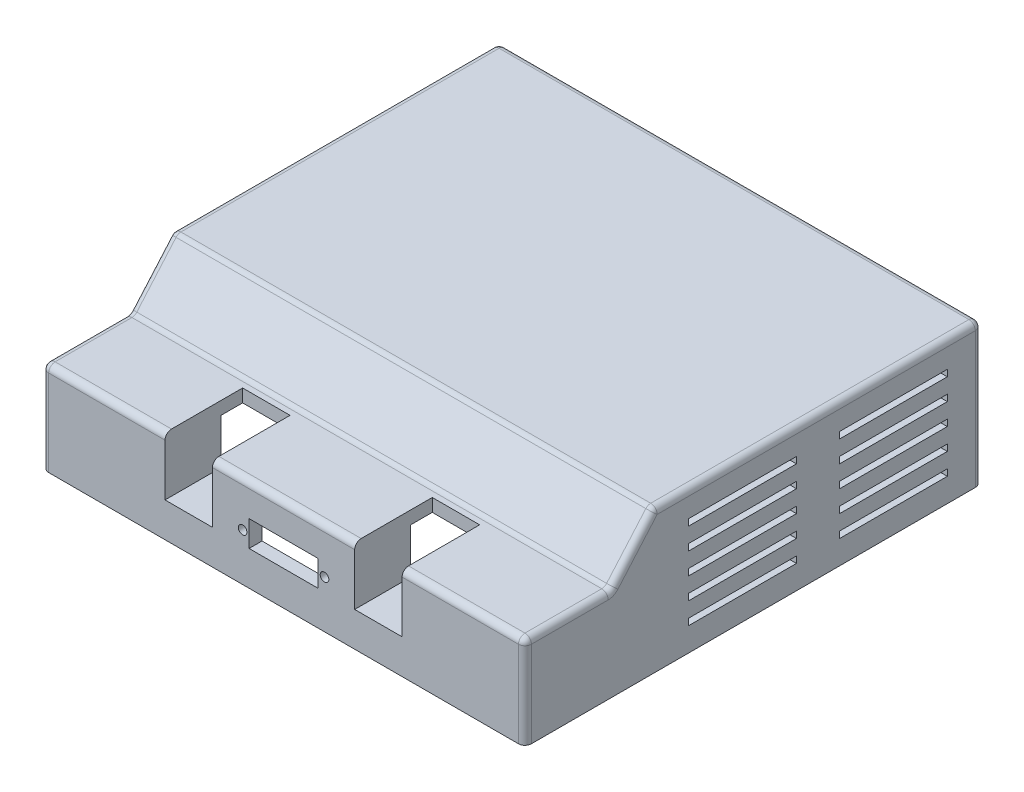
from build123d import *

# Parameters (mm, degrees)
SKETCH1_W            = 112
SKETCH1_H            = 106
BOSS_EXTRUDE1_DEPTH  = 3
SKETCH3_W            = 112
SKETCH3_H            = 106
BOSS_EXTRUDE2_DEPTH  = 30
SKETCH4_R            = 1.5
CUT_EXTRUDE1_DEPTH   = 15
SKETCH5_R            = 1
SKETCH5_W            = 16
SKETCH5_H            = 6
CUT_EXTRUDE2_DEPTH   = 3
SKETCH7_W            = 30
SKETCH7_H            = 14.5
CUT_EXTRUDE4_DEPTH   = 112
SKETCH9_W            = 112
SKETCH9_H            = 20
BOSS_EXTRUDE3_DEPTH  = 3
SKETCH10_W           = 11
SKETCH10_H           = 18
CUT_EXTRUDE5_DEPTH   = 13.5
BOSS_EXTRUDE4_DEPTH  = 112
BOSS_EXTRUDE5_DEPTH  = 3
BOSS_EXTRUDE6_DEPTH  = 3
SKETCH19_W           = 9
SKETCH19_H           = 10
CUT_EXTRUDE7_DEPTH   = 3
SKETCH20_W           = 12
SKETCH20_H           = 13
SKETCH20_W_2         = 9
SKETCH20_H_2         = 10
BOSS_EXTRUDE8_DEPTH  = 3
SKETCH21_W           = 15
SKETCH21_H           = 8.5
CUT_EXTRUDE8_DEPTH   = 3
SKETCH23_W           = 25
SKETCH23_H           = 1.5
CUT_EXTRUDE9_DEPTH   = 3
SKETCH24_W           = 25
SKETCH24_H           = 1.5
CUT_EXTRUDE10_DEPTH  = 3
FILLET1_R            = 1.5
BOSS_EXTRUDE16_DEPTH = 10


with BuildPart() as part:
    # Sketch1 → Boss-Extrude1 (new body)
    with BuildSketch(Plane(origin=(0, 0, 0), x_dir=(1, 0, 0), z_dir=(0, 1, 0))):
        Rectangle(SKETCH1_W, SKETCH1_H)
    extrude(amount=BOSS_EXTRUDE1_DEPTH)

    # Sketch3 → Boss-Extrude2 (add)
    with BuildSketch(Plane.XZ):
        Rectangle(SKETCH3_W, SKETCH3_H)
        with BuildLine():
            Line((44.381049961, -50), (-44.381049961, -50))
            ThreePointArc((-44.381049961, -50), (-47.452820621, -44.577071492), (-52.830188679, -41.426223771))
            Line((-52.830188679, -41.426223771), (-52.830188679, 41.426223771))
            ThreePointArc((-52.830188679, 41.426223771), (-47.452820621, 44.577071492), (-44.381049961, 50))
            Line((-44.381049961, 50), (44.381049961, 50))
            ThreePointArc((44.381049961, 50), (47.452820621, 44.577071492), (52.830188679, 41.426223771))
            Line((52.830188679, 41.426223771), (52.830188679, -41.426223771))
            ThreePointArc((52.830188679, -41.426223771), (47.452820621, -44.577071492), (44.381049961, -50))
        make_face(mode=Mode.SUBTRACT)
    extrude(amount=BOSS_EXTRUDE2_DEPTH)

    # Sketch4 → Cut-Extrude1 (cut)
    with BuildSketch(Plane.XZ.offset(30)):
        with Locations((-51.5, -48.5)):
            Circle(SKETCH4_R)
        with Locations((51.5, -48.5)):
            Circle(SKETCH4_R)
        with Locations((-51.5, 48.5)):
            Circle(SKETCH4_R)
        with Locations((51.5, 48.5)):
            Circle(SKETCH4_R)
    extrude(amount=-CUT_EXTRUDE1_DEPTH, mode=Mode.SUBTRACT)

    # Sketch5 → Cut-Extrude2 (cut)
    with BuildSketch(Plane.XY.offset(53)):
        with Locations((9.5, -19)):
            Circle(SKETCH5_R)
        with Locations((-9.5, -19)):
            Circle(SKETCH5_R)
        with Locations((0, -19)):
            Rectangle(SKETCH5_W, SKETCH5_H)
    extrude(amount=-CUT_EXTRUDE2_DEPTH, mode=Mode.SUBTRACT)

    # Sketch7 → Cut-Extrude4 (cut)
    with BuildSketch(Plane(origin=(56, 0, 0), x_dir=(0, 0, -1), z_dir=(1, 0, 0))):
        with Locations((-38, -4.25)):
            Rectangle(SKETCH7_W, SKETCH7_H)
    extrude(amount=-CUT_EXTRUDE4_DEPTH, mode=Mode.SUBTRACT)

    # Sketch9 → Boss-Extrude3 (add)
    with BuildSketch(Plane(origin=(0, -11.5, 0), x_dir=(1, 0, 0), z_dir=(0, 1, 0))):
        with Locations((0, -43)):
            Rectangle(SKETCH9_W, SKETCH9_H)
    extrude(amount=BOSS_EXTRUDE3_DEPTH)

    # Sketch10 → Cut-Extrude5 (cut)
    with BuildSketch(Plane(origin=(0, -8.5, 0), x_dir=(1, 0, 0), z_dir=(0, 1, 0))):
        with Locations((-22, -44)):
            Rectangle(SKETCH10_W, SKETCH10_H)
        with Locations((22, -44)):
            Rectangle(SKETCH10_W, SKETCH10_H)
    extrude(amount=-CUT_EXTRUDE5_DEPTH, mode=Mode.SUBTRACT)

    # Sketch11 → Boss-Extrude4 (add)
    with BuildSketch(Plane(origin=(56, 0, 0), x_dir=(0, 0, -1), z_dir=(1, 0, 0))):
        Polygon((-33, -8.5), (-23, 3), (-23, 0), (-33, -11.5), align=None)
    extrude(amount=-BOSS_EXTRUDE4_DEPTH)

    # Sketch13 → Boss-Extrude5 (add)
    with BuildSketch(Plane(origin=(56, 0, 0), x_dir=(0, 0, -1), z_dir=(1, 0, 0))):
        Polygon((-33, -11.5), (-23, 0), (-23, -11.5), align=None)
    extrude(amount=-BOSS_EXTRUDE5_DEPTH)

    # Sketch14 → Boss-Extrude6 (add)
    with BuildSketch(Plane.ZY.offset(56)):
        Polygon((23, 0), (23, -11.5), (33, -11.5), align=None)
    extrude(amount=-BOSS_EXTRUDE6_DEPTH)

    # Sketch19 → Cut-Extrude7 (cut)
    with BuildSketch(Plane(origin=(0, 0, -53), x_dir=(-1, 0, 0), z_dir=(0, 0, -1))):
        with Locations((23, -16.5)):
            Rectangle(SKETCH19_W, SKETCH19_H)
    extrude(amount=-CUT_EXTRUDE7_DEPTH, mode=Mode.SUBTRACT)

    # Sketch20 → Boss-Extrude8 (add)
    with BuildSketch(Plane.XY.offset(-53)):
        with Locations((-23, -16.5)):
            Rectangle(SKETCH20_W, SKETCH20_H)
        with Locations((-23, -16.5)):
            Rectangle(SKETCH20_W_2, SKETCH20_H_2, mode=Mode.SUBTRACT)
    extrude(amount=BOSS_EXTRUDE8_DEPTH)

    # Sketch21 → Cut-Extrude8 (cut)
    with BuildSketch(Plane(origin=(0, 0, -53), x_dir=(-1, 0, 0), z_dir=(0, 0, -1))):
        with Locations((-21, -15)):
            Rectangle(SKETCH21_W, SKETCH21_H)
    extrude(amount=-CUT_EXTRUDE8_DEPTH, mode=Mode.SUBTRACT)

    # Sketch23 → Cut-Extrude9 (cut)
    with BuildSketch(Plane(origin=(56, 0, 0), x_dir=(0, 0, -1), z_dir=(1, 0, 0))):
        with Locations((32.5, -8.75)):
            Rectangle(SKETCH23_W, SKETCH23_H)
        with Locations((32.5, -3.75)):
            Rectangle(SKETCH23_W, SKETCH23_H)
        with Locations((32.5, -13.75)):
            Rectangle(SKETCH23_W, SKETCH23_H)
        with Locations((32.5, -18.75)):
            Rectangle(SKETCH23_W, SKETCH23_H)
        with Locations((32.5, -23.75)):
            Rectangle(SKETCH23_W, SKETCH23_H)
        with Locations((-2.5, -23.75)):
            Rectangle(SKETCH23_W, SKETCH23_H)
        with Locations((-2.5, -18.75)):
            Rectangle(SKETCH23_W, SKETCH23_H)
        with Locations((-2.5, -13.75)):
            Rectangle(SKETCH23_W, SKETCH23_H)
        with Locations((-2.5, -8.75)):
            Rectangle(SKETCH23_W, SKETCH23_H)
        with Locations((-2.5, -3.75)):
            Rectangle(SKETCH23_W, SKETCH23_H)
    extrude(amount=-CUT_EXTRUDE9_DEPTH, mode=Mode.SUBTRACT)

    # Sketch24 → Cut-Extrude10 (cut)
    with BuildSketch(Plane.ZY.offset(56)):
        with Locations((2.5, -7.25)):
            Rectangle(SKETCH24_W, SKETCH24_H)
        with Locations((2.5, -3.75)):
            Rectangle(SKETCH24_W, SKETCH24_H)
        with Locations((2.5, -12.25)):
            Rectangle(SKETCH24_W, SKETCH24_H)
        with Locations((2.5, -17.25)):
            Rectangle(SKETCH24_W, SKETCH24_H)
        with Locations((2.5, -22.25)):
            Rectangle(SKETCH24_W, SKETCH24_H)
        with Locations((-32.5, -22.25)):
            Rectangle(SKETCH24_W, SKETCH24_H)
        with Locations((-32.5, -17.25)):
            Rectangle(SKETCH24_W, SKETCH24_H)
        with Locations((-32.5, -12.25)):
            Rectangle(SKETCH24_W, SKETCH24_H)
        with Locations((-32.5, -7.25)):
            Rectangle(SKETCH24_W, SKETCH24_H)
        with Locations((-32.5, -3.75)):
            Rectangle(SKETCH24_W, SKETCH24_H)
    extrude(amount=-CUT_EXTRUDE10_DEPTH, mode=Mode.SUBTRACT)

    # Fillet1
    fillet1_edges = [part.edges().sort_by_distance(p)[0] for p in [
        (56, -8.5, 43),
        (-56, -8.5, 43),
        (0, -8.5, 33),
        (-56, -2.75, 28),
        (56, -2.75, 28),
        (0, 3, -53),
        (56, 3, -15),
        (0, 3, 23),
        (-56, 3, -15),
        (-56, -13.5, -53),
        (56, -13.5, -53),
        (56, -19.25, 53),
        (-56, -19.25, 53),
        (41.75, -8.5, 53),
        (-41.75, -8.5, 53),
        (0, -8.5, 53),
    ]]
    fillet(fillet1_edges, radius=FILLET1_R)

    # Sketch31 → Boss-Extrude16 (add)
    with BuildSketch(Plane(origin=(0, 0, 50), x_dir=(-1, 0, 0), z_dir=(0, 0, -1))):
        Polygon((16.5, -11.5), (14.5, -11.5), (14.5, -23.5), (29.5, -23.5), (29.5, -11.5), (27.5, -11.5), (27.5, -22), (16.5, -22), align=None)
        Polygon((-27.5, -11.5), (-29.5, -11.5), (-29.5, -23.5), (-14.5, -23.5), (-14.5, -11.5), (-16.5, -11.5), (-16.5, -22), (-27.5, -22), align=None)
    extrude(amount=BOSS_EXTRUDE16_DEPTH)


solid = part.part
